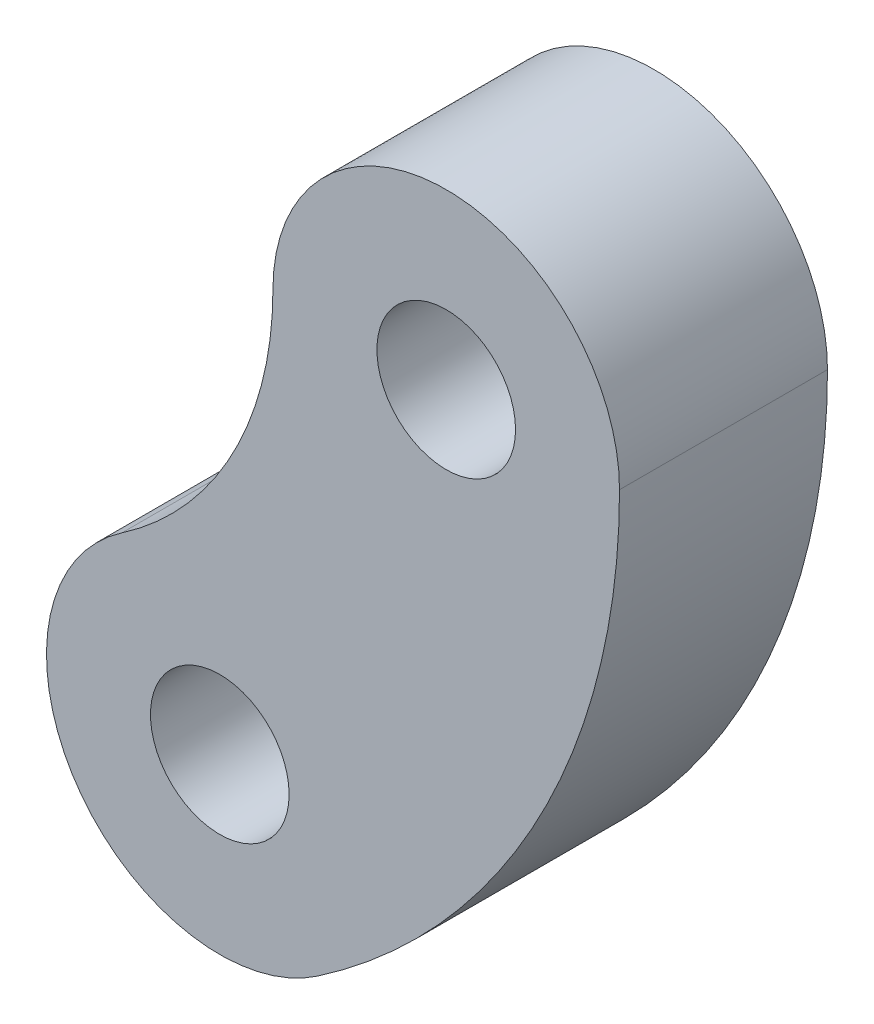
from build123d import *

# Parameters (mm, degrees)
SKETCH1_R           = 1
BOSS_EXTRUDE1_DEPTH = 1.5


with BuildPart() as part:
    # Sketch1 → Boss-Extrude1 (new, symmetric)
    with BuildSketch(Plane.XY):
        with BuildLine():
            ThreePointArc((5.644444444, -8.254710589), (8.844332774, -4.666666667), (10, 0))
            ThreePointArc((10, 0), (7.5, 2.5), (5, 0))
            ThreePointArc((5, 0), (4.422166387, -2.333333333), (2.822222222, -4.127355295))
            ThreePointArc((2.822222222, -4.127355295), (2.169655686, -7.602144053), (5.644444444, -8.254710589))
        make_face()
        with Locations((4.233333333, -6.191032942)):
            Circle(SKETCH1_R, mode=Mode.SUBTRACT)
        with Locations((7.5, 0)):
            Circle(SKETCH1_R, mode=Mode.SUBTRACT)
    extrude(amount=BOSS_EXTRUDE1_DEPTH, both=True)


solid = part.part
